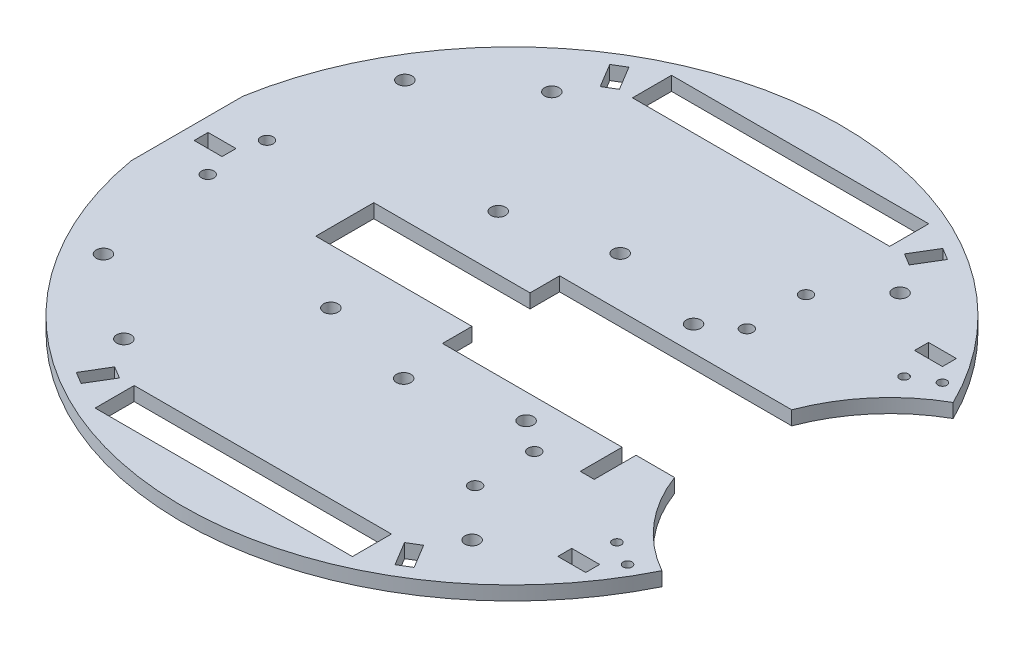
from build123d import *

# Parameters (mm, degrees)
SKETCH1_R           = 1.397
SKETCH1_R_2         = 1.651
SKETCH1_R_3         = 1.016
SKETCH1_W           = 58.544107304
SKETCH1_H           = 8.89
SKETCH1_W_2         = 6.35
SKETCH1_H_2         = 3.175
BOSS_EXTRUDE1_DEPTH = 3.175


with BuildPart() as part:
    # Sketch1 → Boss-Extrude1 (new body)
    with BuildSketch(Plane(origin=(0, 0, 0), x_dir=(1, 0, 0), z_dir=(0, 1, 0))):
        with BuildLine():
            Line((38.407265908, 13.335), (41.582265908, 13.335))
            Line((41.582265908, 13.335), (50.342102347, 13.335))
            ThreePointArc((50.342102347, 13.335), (57.058059725, 24.74076345), (67.270928268, 33.160552015))
            ThreePointArc((67.270928268, 33.160552015), (-10.756431789, 74.224653419), (-73.916912814, 12.7))
            Line((-73.916912814, 12.7), (-73.916912814, -12.7))
            ThreePointArc((-73.916912814, -12.7), (-10.756431789, -74.224653419), (67.270928268, -33.160552015))
            ThreePointArc((67.270928268, -33.160552015), (60.584216496, -28.355013333), (55.086193863, -22.225))
            ThreePointArc((55.086193863, -22.225), (52.41895011, -17.937530518), (50.342102347, -13.335))
            Line((50.342102347, -13.335), (46.281265908, -13.335))
            Line((46.281265908, -13.335), (41.582265908, -13.335))
            Line((41.582265908, -13.335), (41.582265908, -22.86))
            Line((41.582265908, -22.86), (38.407265908, -22.86))
            Line((38.407265908, -22.86), (38.407265908, -13.335))
            Line((38.407265908, -13.335), (-2.486734092, -13.335))
            Line((-2.486734092, -13.335), (-2.486734092, -6.604))
            Line((-2.486734092, -6.604), (-38.046734092, -6.604))
            Line((-38.046734092, -6.604), (-38.046734092, 6.604))
            Line((-38.046734092, 6.604), (-2.486734092, 6.604))
            Line((-2.486734092, 6.604), (-2.486734092, 13.335))
            Line((-2.486734092, 13.335), (38.407265908, 13.335))
        make_face()
        with Locations(Location((-62.486912814, 6.731, 0), (0, 0, 270))):
            Circle(SKETCH1_R, mode=Mode.SUBTRACT)
        with Locations(Location((-62.486912814, -6.731, 0), (0, 0, 270))):
            Circle(SKETCH1_R, mode=Mode.SUBTRACT)
        with Locations(Location((-39.626912814, -48.698461806, 0), (0, 0, 270))):
            Circle(SKETCH1_R_2, mode=Mode.SUBTRACT)
        with Locations(Location((39.626912814, -48.698461806, 0), (0, 0, 270))):
            Circle(SKETCH1_R_2, mode=Mode.SUBTRACT)
        with Locations(Location((39.626912814, 48.698461806, 0), (0, 0, 90))):
            Circle(SKETCH1_R_2, mode=Mode.SUBTRACT)
        with Locations(Location((0, -24.638, 0), (0, 0, 270))):
            Circle(SKETCH1_R_2, mode=Mode.SUBTRACT)
        with Locations(Location((-39.626912814, 48.698461806, 0), (0, 0, 90))):
            Circle(SKETCH1_R_2, mode=Mode.SUBTRACT)
        with Locations(Location((0, 24.638, 0), (0, 0, 90))):
            Circle(SKETCH1_R_2, mode=Mode.SUBTRACT)
        with Locations(Location((29.272053652, -37.649461806, 0), (0, 0, 270))):
            Circle(SKETCH1_R, mode=Mode.SUBTRACT)
        with Locations(Location((-58.676912814, 34.29, 0), (0, 0, 270))):
            Circle(SKETCH1_R_2, mode=Mode.SUBTRACT)
        with Locations(Location((62.141053559, -35.830642926, 0), (0, 0, 270))):
            Circle(SKETCH1_R_3, mode=Mode.SUBTRACT)
        with Locations(Location((56.570777105, -32.679132142, 0), (0, 0, 270))):
            Circle(SKETCH1_R_3, mode=Mode.SUBTRACT)
        with Locations(Location((-58.676912814, -34.29, 0), (0, 0, 270))):
            Circle(SKETCH1_R_2, mode=Mode.SUBTRACT)
        with Locations(Location((29.272053652, -24.187461806, 0), (0, 0, 270))):
            Circle(SKETCH1_R, mode=Mode.SUBTRACT)
        with Locations(Location((29.272053652, 37.649461806, 0), (0, 0, 90))):
            Circle(SKETCH1_R, mode=Mode.SUBTRACT)
        with Locations(Location((29.272053652, 24.187461806, 0), (0, 0, 90))):
            Circle(SKETCH1_R, mode=Mode.SUBTRACT)
        with Locations(Location((62.141053559, 35.830642926, 0), (0, 0, 270))):
            Circle(SKETCH1_R_3, mode=Mode.SUBTRACT)
        with Locations(Location((56.570777105, 32.679132142, 0), (0, 0, 270))):
            Circle(SKETCH1_R_3, mode=Mode.SUBTRACT)
        with Locations(Location((22.278265908, 19.05, 0), (0, 0, 270))):
            Circle(SKETCH1_R_2, mode=Mode.SUBTRACT)
        with Locations(Location((22.278265908, -19.05, 0), (0, 0, 270))):
            Circle(SKETCH1_R_2, mode=Mode.SUBTRACT)
        with Locations(Location((-22.171734092, -19.05, 0), (0, 0, 270))):
            Circle(SKETCH1_R_2, mode=Mode.SUBTRACT)
        with Locations(Location((-22.171734092, 19.05, 0), (0, 0, 270))):
            Circle(SKETCH1_R_2, mode=Mode.SUBTRACT)
        with Locations((0, -61.144461806)):
            Rectangle(SKETCH1_W, SKETCH1_H, mode=Mode.SUBTRACT)
        with Locations((0, 61.144461806)):
            Rectangle(SKETCH1_W, SKETCH1_H, mode=Mode.SUBTRACT)
        with Locations((55.791053559, -40.593142926)):
            Rectangle(SKETCH1_W_2, SKETCH1_H_2, mode=Mode.SUBTRACT)
        with Locations((55.791053559, 40.593142926)):
            Rectangle(SKETCH1_W_2, SKETCH1_H_2, mode=Mode.SUBTRACT)
        Polygon((32.44100721, -56.895314679), (35.719111901, -62.333745485), (38.438327304, -60.694693139), (35.160222613, -55.256262334), align=None, mode=Mode.SUBTRACT)
        Polygon((-32.44100721, -56.895314679), (-35.160222613, -55.256262334), (-38.438327304, -60.694693139), (-35.719111901, -62.333745485), align=None, mode=Mode.SUBTRACT)
        Polygon((-35.160222613, 55.256262334), (-38.438327304, 60.694693139), (-35.719111901, 62.333745485), (-32.44100721, 56.895314679), align=None, mode=Mode.SUBTRACT)
        Polygon((35.160222613, 55.256262334), (38.438327304, 60.694693139), (35.719111901, 62.333745485), (32.44100721, 56.895314679), align=None, mode=Mode.SUBTRACT)
        with Locations((-67.566912814, 0)):
            Rectangle(SKETCH1_W_2, SKETCH1_H_2, mode=Mode.SUBTRACT)
    extrude(amount=BOSS_EXTRUDE1_DEPTH)


solid = part.part
